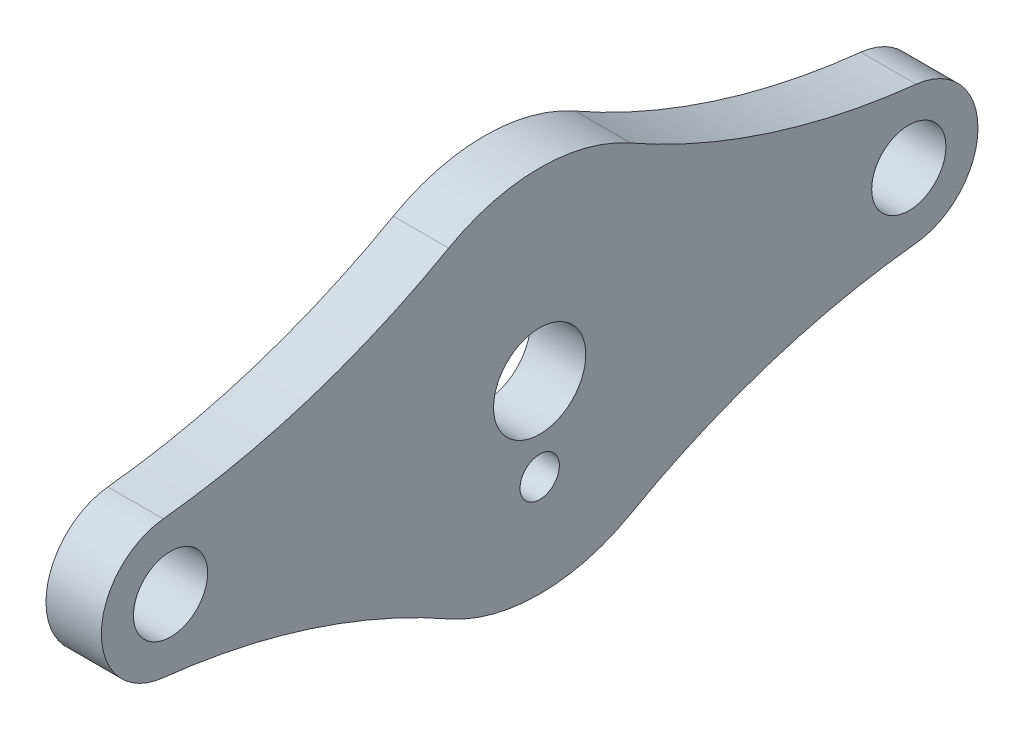
from build123d import *

# Parameters (mm, degrees)
BOSS_EXTRUDE1_DEPTH    = 3.81
F_10_CLEARANCE_HOLE1_D = 5.1054
F_6_32_TAPPED_HOLE1_D  = 2.7051
SKETCH4_R              = 3.175
CUT_EXTRUDE1_DEPTH     = 33.948179104


with BuildPart() as part:
    # Sketch1 → Boss-Extrude1 (new body)
    with BuildSketch(Plane(origin=(0, 0, 0), x_dir=(0, 0, -1), z_dir=(1, 0, 0))):
        with BuildLine():
            ThreePointArc((-25.906015625, 4.73554162), (-30.1625, 0), (-25.906015625, -4.73554162))
            ThreePointArc((-25.906015625, -4.73554162), (-15.759385528, -6.884569442), (-6.260703125, -11.049597114))
            ThreePointArc((-6.260703125, -11.049597114), (0, -12.7), (6.260703125, -11.049597114))
            ThreePointArc((6.260703125, -11.049597114), (15.759385528, -6.884569442), (25.906015625, -4.73554162))
            ThreePointArc((25.906015625, -4.73554162), (30.1625, 0), (25.906015625, 4.73554162))
            ThreePointArc((25.906015625, 4.73554162), (15.759385528, 6.884569442), (6.260703125, 11.049597114))
            ThreePointArc((6.260703125, 11.049597114), (0, 12.7), (-6.260703125, 11.049597114))
            ThreePointArc((-6.260703125, 11.049597114), (-15.759385528, 6.884569442), (-25.906015625, 4.73554162))
        make_face()
    extrude(amount=-BOSS_EXTRUDE1_DEPTH)

    # #10 Clearance Hole1 (through all)
    with Locations(Plane.ZY.offset(3.81)):
        with Locations((-25.4, 0), (25.4, 0)):
            Hole(F_10_CLEARANCE_HOLE1_D / 2)

    # #6-32 Tapped Hole1 (through all)
    with Locations(Plane.ZY.offset(3.81)):
        with Locations((0, -5.715)):
            Hole(F_6_32_TAPPED_HOLE1_D / 2)

    # Sketch4 → Cut-Extrude1 (cut, through all)
    with BuildSketch(Plane.ZY.offset(3.81)):
        Circle(SKETCH4_R)
    extrude(amount=-CUT_EXTRUDE1_DEPTH, mode=Mode.SUBTRACT)


solid = part.part
